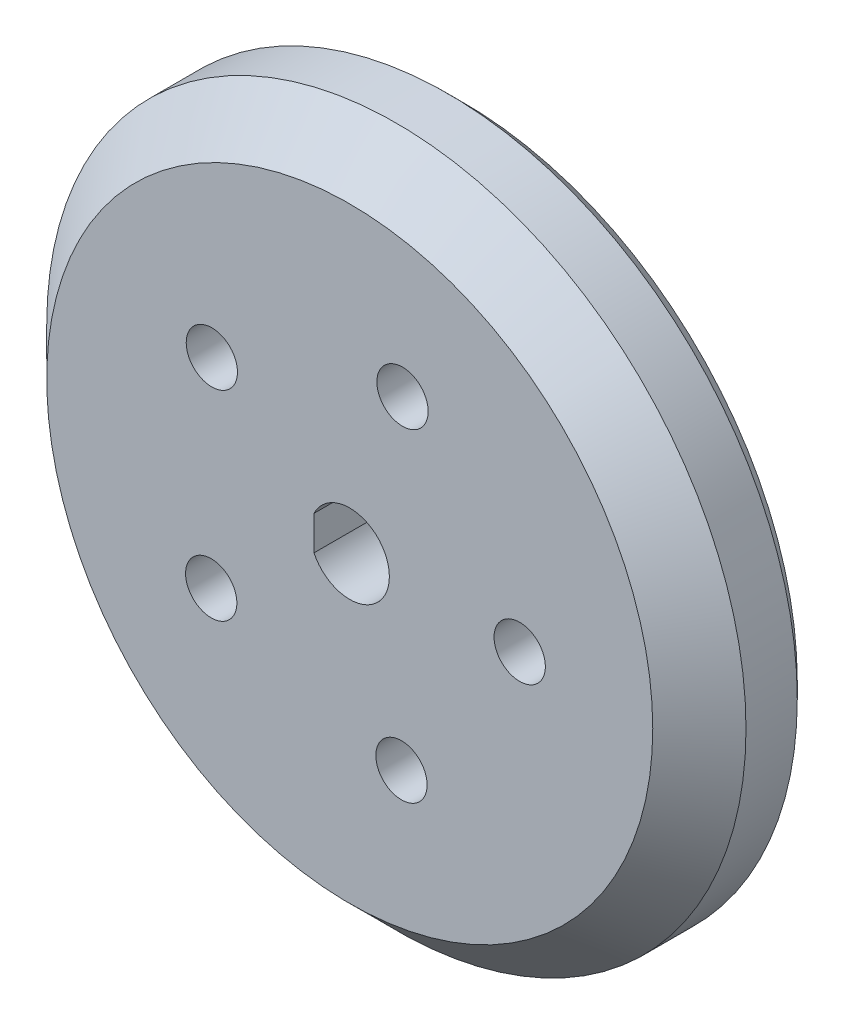
from build123d import *

# Parameters (mm, degrees)
SKETCH1_R               = 22.5
SKETCH1_R_2             = 2.55
BOSS_EXTRUDE1_DEPTH     = 7.3
SKETCH2_R               = 1.525
CUT_EXTRUDE1_DEPTH      = 3.4
CUT_EXTRUDE2_DEPTH      = 33.646439316
CUT_EXTRUDE2_DEPTH_BACK = 33.646439316
SKETCH3_R               = 2.55
SKETCH3_R_2             = 1.65
CHAMFER7_SIZE           = 1
CHAMFER8_SIZE           = 3
CUT_EXTRUDE3_DEPTH      = 2
BOSS_EXTRUDE2_START     = -5.3
BOSS_EXTRUDE2_DEPTH     = 5.3


with BuildPart() as part:
    # Sketch1 → Boss-Extrude1 (new body)
    with BuildSketch(Plane.XY):
        Circle(SKETCH1_R)
        Circle(SKETCH1_R_2, mode=Mode.SUBTRACT)
    extrude(amount=BOSS_EXTRUDE1_DEPTH)

    # Sketch2 → Cut-Extrude1 (cut)
    with BuildSketch(Plane(origin=(0, 0, 0), x_dir=(-1, 0, 0), z_dir=(0, 0, -1))):
        with Locations((-18.85, 0)):
            Circle(SKETCH2_R)
        with Locations((-5.824970344, 17.927415332)):
            Circle(SKETCH2_R)
        with Locations((15.249970344, 11.079752006)):
            Circle(SKETCH2_R)
        with Locations((15.249970344, -11.079752006)):
            Circle(SKETCH2_R)
        with Locations((-5.824970344, -17.927415332)):
            Circle(SKETCH2_R)
    extrude(amount=-CUT_EXTRUDE1_DEPTH, mode=Mode.SUBTRACT)

    # Sketch3 → Cut-Extrude2 (cut, two sides: drawn at the far end of the back side and taken through both)
    with BuildSketch(Plane(origin=(0, 0, 0), x_dir=(-1, 0, 0), z_dir=(0, 0, -1)).offset(-CUT_EXTRUDE2_DEPTH_BACK)):
        with Locations(Location((0, 0, 0), (0, 0, 180))):
            Circle(SKETCH3_R)
        with Locations((-10.9375, 0)):
            Circle(SKETCH3_R_2)
        with Locations((-3.395324226, 10.449733473)):
            Circle(SKETCH3_R_2)
        with Locations((8.873623376, 6.505843285)):
            Circle(SKETCH3_R_2)
        with Locations((8.914074226, -6.381348371)):
            Circle(SKETCH3_R_2)
        with Locations((-3.329873376, -10.402180647)):
            Circle(SKETCH3_R_2)
    extrude(amount=CUT_EXTRUDE2_DEPTH + CUT_EXTRUDE2_DEPTH_BACK, mode=Mode.SUBTRACT)

    # Chamfer7
    chamfer7_edges = [part.edges().sort_by_distance(p)[0] for p in [
        (-22.5, 0, 0),
    ]]
    chamfer(chamfer7_edges, length=CHAMFER7_SIZE)

    # Chamfer8
    chamfer8_edges = [part.edges().sort_by_distance(p)[0] for p in [
        (-22.5, 0, 7.3),
    ]]
    chamfer(chamfer8_edges, length=CHAMFER8_SIZE)

    # Sketch8 → Cut-Extrude3 (cut)
    with BuildSketch(Plane(origin=(0, 0, 0), x_dir=(-1, 0, 0), z_dir=(0, 0, -1))):
        with BuildLine():
            Line((-5.65, -6.549809158), (-5.65, 6.549809158))
            ThreePointArc((-5.65, 6.549809158), (8.65, 0), (-5.65, -6.549809158))
        make_face()
    extrude(amount=-CUT_EXTRUDE3_DEPTH, mode=Mode.SUBTRACT)

    # Sketch10 → Boss-Extrude2 (add)
    with BuildSketch(Plane.XY.offset(7.3).offset(BOSS_EXTRUDE2_START)):
        with BuildLine():
            Line((-2.3, -1.101135777), (-2.3, 1.101135777))
            ThreePointArc((-2.3, 1.101135777), (-2.55, 0), (-2.3, -1.101135777))
        make_face()
    extrude(amount=BOSS_EXTRUDE2_DEPTH)


solid = part.part
